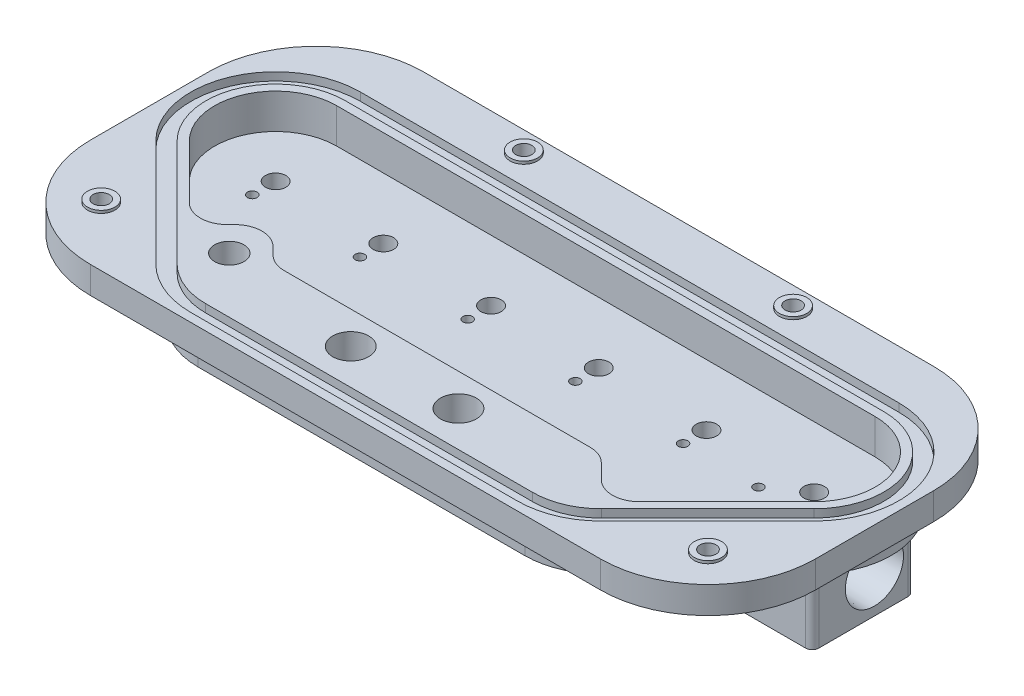
from build123d import *

# Parameters (mm, degrees)
BOSS_EXTRUDE1_DEPTH              = 12.065
SHELL1_T                         = -3.81
SKETCH3_W                        = 24.13
SKETCH3_H                        = 17.78
BOSS_EXTRUDE2_DEPTH              = 74.295
FILLET1_R                        = 1.5875
F_10_32_TAPPED_HOLE1_D           = 4.0386
F_10_32_TAPPED_HOLE1_DEPTH       = 12.02944
F_10_32_TAPPED_HOLE1_CBORE_D     = 4.826
F_10_32_TAPPED_HOLE1_CBORE_DEPTH = 9.652
F_10_32_TAPPED_HOLE1_TIP         = 1.213317848
F_7_16_0_4375_DIAMETER_HOLE5_D   = 11.1125
F_43_0_089_DIAMETER_HOLE3_D      = 2.2606
F_43_0_089_DIAMETER_HOLE3_DEPTH  = 36.068
F_43_0_089_DIAMETER_HOLE3_TIP    = 0.679152758
F_10_32_TAPPED_HOLE2_D           = 4.0386
F_10_32_TAPPED_HOLE2_DEPTH       = 5.08
F_10_32_TAPPED_HOLE2_CBORE_D     = 4.826
F_10_32_TAPPED_HOLE2_CBORE_DEPTH = 3.81
F_10_32_TAPPED_HOLE2_TIP         = 1.213317848
BOSS_EXTRUDE3_START              = -6.35
SKETCH12_W                       = 171.0436
SKETCH12_H                       = 78.613
BOSS_EXTRUDE3_DEPTH              = 6.35
BOSS_EXTRUDE6_DEPTH              = 8.255
FILLET5_R                        = 6.35
BOSS_EXTRUDE7_DEPTH              = 6.35
FILLET6_R                        = 6.35
F_4_40_TAPPED_HOLE1_D            = 2.2606
F_4_40_TAPPED_HOLE1_DEPTH        = 5.715
F_4_40_TAPPED_HOLE1_CBORE_D      = 2.8448
F_4_40_TAPPED_HOLE1_CBORE_DEPTH  = 3.81
F_4_40_TAPPED_HOLE1_TIP          = 0.679152758
F_5_16_24_TAPPED_HOLE1_D         = 6.9088
CUT_EXTRUDE7_DEPTH               = 1.905
FILLET7_R                        = 25.4
M10X1_5_TAPPED_HOLE1_D           = 8.5
F_6_CLEARANCE_HOLE1_D            = 3.7973
SKETCH59_R                       = 3.2385
SKETCH59_R_2                     = 1.89865
BOSS_EXTRUDE8_DEPTH              = 0.635
SKETCH64_R                       = 5.08
CUT_EXTRUDE9_DEPTH               = 5


with BuildPart() as part:
    # Sketch1 → Boss-Extrude1 (new body)
    with BuildSketch(Plane(origin=(0, 0, 0), x_dir=(1, 0, 0), z_dir=(0, 1, 0))):
        with BuildLine():
            Line((-63.5, 18.034), (63.5, 18.034))
            ThreePointArc((63.5, 18.034), (80.32550927, 6.791554134), (76.377687278, -13.055487278))
            Line((76.377687278, -13.055487278), (51.281210863, -38.151963692))
            ThreePointArc((51.281210863, -38.151963692), (45.430560191, -42.061243489), (38.529247171, -43.434))
            Line((38.529247171, -43.434), (-38.529247171, -43.434))
            ThreePointArc((-38.529247171, -43.434), (-45.430560191, -42.061243489), (-51.281210863, -38.151963692))
            Line((-51.281210863, -38.151963692), (-76.377687278, -13.055487278))
            ThreePointArc((-76.377687278, -13.055487278), (-80.32550927, 6.791554134), (-63.5, 18.034))
        make_face()
    extrude(amount=BOSS_EXTRUDE1_DEPTH)

    # Shell1
    shell1_openings = [part.faces().sort_by_distance(p)[0] for p in [
        (0, 12.065, 10.309491843),
    ]]
    offset(amount=SHELL1_T, openings=shell1_openings, kind=Kind.INTERSECTION)

    # Sketch3 → Boss-Extrude2 (add, symmetric)
    with BuildSketch(Plane(origin=(0, 0, 0), x_dir=(0, 0, -1), z_dir=(1, 0, 0))):
        with Locations((0.635, -8.89)):
            Rectangle(SKETCH3_W, SKETCH3_H)
    extrude(amount=BOSS_EXTRUDE2_DEPTH, both=True)

    # Fillet1
    fillet1_edges = [part.edges().sort_by_distance(p)[0] for p in [
        (-74.295, -8.89, 11.43),
        (-74.295, -8.89, -12.7),
        (74.295, -8.89, 11.43),
        (74.295, -8.89, -12.7),
    ]]
    fillet(fillet1_edges, radius=FILLET1_R)

    # #10-32 Tapped Hole1
    with Locations(Plane(origin=(0, 3.81, 0), x_dir=(1, 0, 0), z_dir=(0, 1, 0))):
        with Locations((-63.5, -0.1778), (-38.1, -0.1778), (-12.7, -0.1778), (12.7, -0.1778), (38.1, -0.1778), (63.5, -0.1778)):
            CounterBoreHole(F_10_32_TAPPED_HOLE1_D / 2, F_10_32_TAPPED_HOLE1_CBORE_D / 2, F_10_32_TAPPED_HOLE1_CBORE_DEPTH, depth=F_10_32_TAPPED_HOLE1_DEPTH)
            with Locations((0, 0, -(F_10_32_TAPPED_HOLE1_DEPTH + F_10_32_TAPPED_HOLE1_TIP / 2))):  # 118° drill point
                Cone(0, F_10_32_TAPPED_HOLE1_D / 2, F_10_32_TAPPED_HOLE1_TIP, mode=Mode.SUBTRACT)

    # 7/16 (0.4375) Diameter Hole5 (through all)
    with Locations(Plane.ZY.offset(74.295)):
        with Locations((-3.2385, -8.89)):
            Hole(F_7_16_0_4375_DIAMETER_HOLE5_D / 2)

    # Sketch61 → 1/4 NPT Tapped Hole2 (revolve, cut)
    with BuildSketch(Plane(origin=(74.295, -8.89, -3.2385), x_dir=(0, 0, -1), z_dir=(0, 1, 0))):
        Polygon((0, 0), (0, 156.0068), (5.5626, 156.0068), (5.5626, 9.906), (6.557984794, 9.906), (6.8545837, 0), align=None)
    revolve(axis=Axis((80.645, -8.89, -3.2385), (-1, 0, 0)), mode=Mode.SUBTRACT)

    # Sketch63 → 1/4 NPT Tapped Hole3 (revolve, cut)
    with BuildSketch(Plane(origin=(-74.295, -8.89, -3.2385), x_dir=(0, 0, 1), z_dir=(0, 1, 0))):
        Polygon((0, 0), (0, 156.0068), (5.5626, 156.0068), (5.5626, 9.906), (6.557984794, 9.906), (6.8545837, 0), align=None)
    revolve(axis=Axis((-80.645, -8.89, -3.2385), (1, 0, 0)), mode=Mode.SUBTRACT)

    # #43 (0.089) Diameter Hole3
    with Locations(Plane(origin=(0, 3.81, 0), x_dir=(1, 0, 0), z_dir=(0, 1, 0))):
        with Locations((-63.5, -5.6896), (-38.1, -5.6896), (-12.7, -5.6896), (12.7, -5.6896), (38.1, -5.6896), (63.5, -5.6896), (55.88, -5.6896)):
            Hole(F_43_0_089_DIAMETER_HOLE3_D / 2, depth=F_43_0_089_DIAMETER_HOLE3_DEPTH)
            with Locations((0, 0, -(F_43_0_089_DIAMETER_HOLE3_DEPTH + F_43_0_089_DIAMETER_HOLE3_TIP / 2))):  # 118° drill point
                Cone(0, F_43_0_089_DIAMETER_HOLE3_D / 2, F_43_0_089_DIAMETER_HOLE3_TIP, mode=Mode.SUBTRACT)

    # #10-32 Tapped Hole2
    with Locations(Plane(origin=(0, -17.78, 0), x_dir=(-1, 0, 0), z_dir=(0, -1, 0))):
        with Locations((63.5, -5.6896), (38.1, -5.6896), (12.7, -5.6896), (-12.7, -5.6896), (-38.1, -5.6896), (-63.5, -5.6896), (-55.88, -5.6896)):
            CounterBoreHole(F_10_32_TAPPED_HOLE2_D / 2, F_10_32_TAPPED_HOLE2_CBORE_D / 2, F_10_32_TAPPED_HOLE2_CBORE_DEPTH, depth=F_10_32_TAPPED_HOLE2_DEPTH)
            with Locations((0, 0, -(F_10_32_TAPPED_HOLE2_DEPTH + F_10_32_TAPPED_HOLE2_TIP / 2))):  # 118° drill point
                Cone(0, F_10_32_TAPPED_HOLE2_D / 2, F_10_32_TAPPED_HOLE2_TIP, mode=Mode.SUBTRACT)

    # Sketch12 → Boss-Extrude3 (add)
    with BuildSketch(Plane(origin=(0, 12.065, 0), x_dir=(1, 0, 0), z_dir=(0, 1, 0)).offset(BOSS_EXTRUDE3_START)):
        with Locations((0, -7.9375)):
            Rectangle(SKETCH12_W, SKETCH12_H)
        with BuildLine():
            Line((63.5, 14.224), (-63.5, 14.224))
            ThreePointArc((-63.5, 14.224), (-76.805528251, 5.333530256), (-73.683610441, -10.361410441))
            Line((-73.683610441, -10.361410441), (-48.587134027, -35.457886856))
            ThreePointArc((-48.587134027, -35.457886856), (-43.972536313, -38.54126247), (-38.529247171, -39.624))
            Line((-38.529247171, -39.624), (38.529247171, -39.624))
            ThreePointArc((38.529247171, -39.624), (43.972536313, -38.54126247), (48.587134027, -35.457886856))
            Line((48.587134027, -35.457886856), (73.683610441, -10.361410441))
            ThreePointArc((73.683610441, -10.361410441), (76.805528251, 5.333530256), (63.5, 14.224))
        make_face(mode=Mode.SUBTRACT)
    extrude(amount=BOSS_EXTRUDE3_DEPTH)

    # Sketch21 → Boss-Extrude6 (add)
    with BuildSketch(Plane(origin=(0, 3.81, 0), x_dir=(1, 0, 0), z_dir=(0, 1, 0))):
        with BuildLine():
            Line((-56.594969658, -27.450051224), (-48.587134027, -35.457886856))
            ThreePointArc((-48.587134027, -35.457886856), (-43.972536313, -38.54126247), (-38.529247171, -39.624))
            Line((-38.529247171, -39.624), (38.529247171, -39.624))
            ThreePointArc((38.529247171, -39.624), (43.972536313, -38.54126247), (48.587134027, -35.457886856))
            Line((48.587134027, -35.457886856), (38.783247171, -25.654))
            Line((38.783247171, -25.654), (-38.634457416, -25.654))
            Line((-38.634457416, -25.654), (-46.716687925, -17.571769491))
            Line((-46.716687925, -17.571769491), (-56.594969658, -27.450051224))
        make_face()
    extrude(amount=BOSS_EXTRUDE6_DEPTH)

    # Fillet5
    fillet5_edges = [part.edges().sort_by_distance(p)[0] for p in [
        (48.587134027, 7.9375, 35.457886856),
        (38.783247171, 7.9375, 25.654),
        (-38.634457416, 7.9375, 25.654),
        (-46.716687925, 7.9375, 17.571769491),
        (-56.594969658, 7.9375, 27.450051224),
    ]]
    fillet(fillet5_edges, radius=FILLET5_R)

    # Sketch28 → Boss-Extrude7 (add)
    with BuildSketch(Plane.XZ):
        with BuildLine():
            Line((-25.248364969, 23.131039796), (-20.401635591, 11.43))
            Line((-20.401635591, 11.43), (-41.828364409, 11.43))
            Line((-41.828364409, 11.43), (-36.981635031, 23.131039796))
            ThreePointArc((-36.981635031, 23.131039796), (-31.115, 27.051), (-25.248364969, 23.131039796))
        make_face()
        with BuildLine():
            Line((25.248364969, 23.131039796), (20.401635591, 11.43))
            Line((20.401635591, 11.43), (41.828364409, 11.43))
            Line((41.828364409, 11.43), (36.981635031, 23.131039796))
            ThreePointArc((36.981635031, 23.131039796), (31.115, 27.051), (25.248364969, 23.131039796))
        make_face()
    extrude(amount=BOSS_EXTRUDE7_DEPTH)

    # Fillet6
    fillet6_edges = [part.edges().sort_by_distance(p)[0] for p in [
        (-41.828364409, -3.175, 11.43),
        (-20.401635591, -3.175, 11.43),
        (20.401635591, -3.175, 11.43),
        (41.828364409, -3.175, 11.43),
    ]]
    fillet(fillet6_edges, radius=FILLET6_R)

    # #4-40 Tapped Hole1
    with Locations(Plane(origin=(0, 3.81, 0), x_dir=(1, 0, 0), z_dir=(0, 1, 0))):
        with Locations((-31.115, -20.701), (31.115, -20.701)):
            CounterBoreHole(F_4_40_TAPPED_HOLE1_D / 2, F_4_40_TAPPED_HOLE1_CBORE_D / 2, F_4_40_TAPPED_HOLE1_CBORE_DEPTH, depth=F_4_40_TAPPED_HOLE1_DEPTH)
            with Locations((0, 0, -(F_4_40_TAPPED_HOLE1_DEPTH + F_4_40_TAPPED_HOLE1_TIP / 2))):  # 118° drill point
                Cone(0, F_4_40_TAPPED_HOLE1_D / 2, F_4_40_TAPPED_HOLE1_TIP, mode=Mode.SUBTRACT)

    # 5/16-24 Tapped Hole1 (through all)
    with Locations(Plane(origin=(0, 0, 0), x_dir=(-1, 0, 0), z_dir=(0, -1, 0))):
        with Locations((46.0375, -28.575)):
            Hole(F_5_16_24_TAPPED_HOLE1_D / 2)

    # Sketch54 → Cut-Extrude7 (cut)
    with BuildSketch(Plane(origin=(0, 12.065, -12.065), x_dir=(1, 0, 0), z_dir=(0, -1, 0))):
        with BuildLine():
            Line((38.529247171, 57.277), (-38.529247171, 57.277))
            ThreePointArc((-38.529247171, 57.277), (-46.110971333, 55.768901298), (-52.53844672, 51.474199549))
            Line((-52.53844672, 51.474199549), (-77.634923135, 26.377723135))
            ThreePointArc((-77.634923135, 26.377723135), (-81.968167079, 4.593034724), (-63.5, -7.747))
            Line((-63.5, -7.747), (63.5, -7.747))
            ThreePointArc((63.5, -7.747), (81.968167079, 4.593034724), (77.634923135, 26.377723135))
            Line((77.634923135, 26.377723135), (52.53844672, 51.474199549))
            ThreePointArc((52.53844672, 51.474199549), (46.110971333, 55.768901298), (38.529247171, 57.277))
        make_face()
        with BuildLine():
            Line((50.023975006, 48.959727835), (75.120451421, 23.863251421))
            ThreePointArc((75.120451421, 23.863251421), (78.682851461, 5.953857009), (63.5, -4.191))
            Line((63.5, -4.191), (-63.5, -4.191))
            ThreePointArc((-63.5, -4.191), (-78.682851461, 5.953857009), (-75.120451421, 23.863251421))
            Line((-75.120451421, 23.863251421), (-50.023975006, 48.959727835))
            ThreePointArc((-50.023975006, 48.959727835), (-44.750149048, 52.483585681), (-38.529247171, 53.721))
            Line((-38.529247171, 53.721), (38.529247171, 53.721))
            ThreePointArc((38.529247171, 53.721), (44.750149048, 52.483585681), (50.023975006, 48.959727835))
        make_face(mode=Mode.SUBTRACT)
    extrude(amount=CUT_EXTRUDE7_DEPTH, mode=Mode.SUBTRACT)

    # Fillet7
    fillet7_edges = [part.edges().sort_by_distance(p)[0] for p in [
        (-85.5218, 8.89, -31.369),
        (85.5218, 8.89, -31.369),
        (85.5218, 8.89, 47.244),
        (-85.5218, 8.89, 47.244),
    ]]
    fillet(fillet7_edges, radius=FILLET7_R)

    # M10x1.5 Tapped Hole1 (through all)
    with Locations(Plane(origin=(0, 12.065, 0), x_dir=(1, 0, 0), z_dir=(0, 1, 0))):
        with Locations((-12.7, -33.274), (12.7, -33.274)):
            Hole(M10X1_5_TAPPED_HOLE1_D / 2)

    # #6 Clearance Hole1 (through all)
    with Locations(Plane(origin=(0, 12.065, 0), x_dir=(1, 0, 0), z_dir=(0, 1, 0))):
        with Locations((-71.5518, -33.274), (-31.75, 26.6065), (71.5518, -33.274), (31.75, 26.6065)):
            Hole(F_6_CLEARANCE_HOLE1_D / 2)

    # Sketch59 → Boss-Extrude8 (add)
    # profile 1 of 4: a face of its own
    with BuildSketch(Plane(origin=(0, 12.065, 0), x_dir=(1, 0, 0), z_dir=(0, 1, 0))):
        with Locations(Location((-31.75, 26.6065, 0), (0, 0, 270))):
            Circle(SKETCH59_R)
        with Locations(Location((-31.75, 26.6065, 0), (0, 0, 270))):
            Circle(SKETCH59_R_2, mode=Mode.SUBTRACT)
    # profile 2 of 4: a face of its own
    with BuildSketch(Plane(origin=(0, 12.065, 0), x_dir=(1, 0, 0), z_dir=(0, 1, 0))):
        with Locations(Location((-71.5518, -33.274, 0), (0, 0, 270))):
            Circle(SKETCH59_R)
        with Locations(Location((-71.5518, -33.274, 0), (0, 0, 270))):
            Circle(SKETCH59_R_2, mode=Mode.SUBTRACT)
    # profile 3 of 4: a face of its own
    with BuildSketch(Plane(origin=(0, 12.065, 0), x_dir=(1, 0, 0), z_dir=(0, 1, 0))):
        with Locations(Location((71.5518, -33.274, 0), (0, 0, 90))):
            Circle(SKETCH59_R)
        with Locations(Location((71.5518, -33.274, 0), (0, 0, 270))):
            Circle(SKETCH59_R_2, mode=Mode.SUBTRACT)
    # profile 4 of 4: a face of its own
    with BuildSketch(Plane(origin=(0, 12.065, 0), x_dir=(1, 0, 0), z_dir=(0, 1, 0))):
        with Locations(Location((31.75, 26.6065, 0), (0, 0, 90))):
            Circle(SKETCH59_R)
        with Locations(Location((31.75, 26.6065, 0), (0, 0, 270))):
            Circle(SKETCH59_R_2, mode=Mode.SUBTRACT)
    extrude(amount=BOSS_EXTRUDE8_DEPTH)

    # Sketch64 → Cut-Extrude9 (cut)
    with BuildSketch(Plane.XZ):
        with Locations(Location((-12.7, 33.274, 0), (0, 0, 270))):
            Circle(SKETCH64_R)
        with Locations(Location((12.7, 33.274, 0), (0, 0, 270))):
            Circle(SKETCH64_R)
    extrude(amount=-CUT_EXTRUDE9_DEPTH, mode=Mode.SUBTRACT)


solid = part.part
